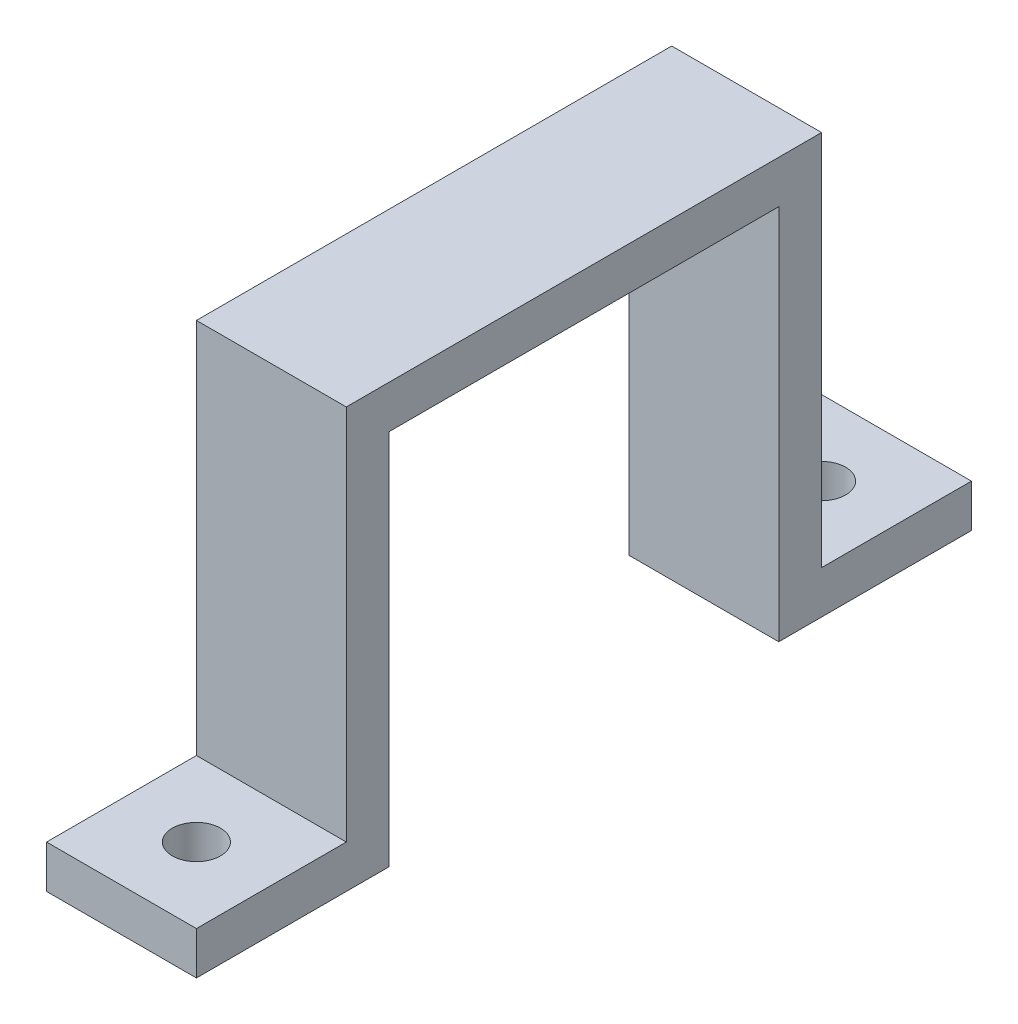
from build123d import *

# Parameters (mm, degrees)
STRAP_DEPTH        = 7
EAR_HOLES_M4_START = -0.5
SKETCH2_R          = 2.25
EAR_HOLES_M4_DEPTH = 5


with BuildPart() as part:
    # Sketch1 → Strap (new, symmetric)
    with BuildSketch(Plane(origin=(0, 0, 0), x_dir=(0, 0, -1), z_dir=(1, 0, 0))):
        Polygon((-36.2, 0), (-18.2, 0), (-18.2, 35.2), (18.2, 35.2), (18.2, 0), (36.2, 0), (36.2, 4), (22.2, 4), (22.2, 39.2), (-22.2, 39.2), (-22.2, 4), (-36.2, 4), align=None)
    extrude(amount=STRAP_DEPTH, both=True)

    # Sketch2 → Ear_Holes_M4 (cut)
    with BuildSketch(Plane(origin=(0, 0, 0), x_dir=(1, 0, 0), z_dir=(0, 1, 0)).offset(EAR_HOLES_M4_START)):
        with Locations(Location((0, 29.2, 0), (0, 0, 90))):
            Circle(SKETCH2_R)
        with Locations(Location((0, -29.2, 0), (0, 0, 90))):
            Circle(SKETCH2_R)
    extrude(amount=EAR_HOLES_M4_DEPTH, mode=Mode.SUBTRACT)


solid = part.part
